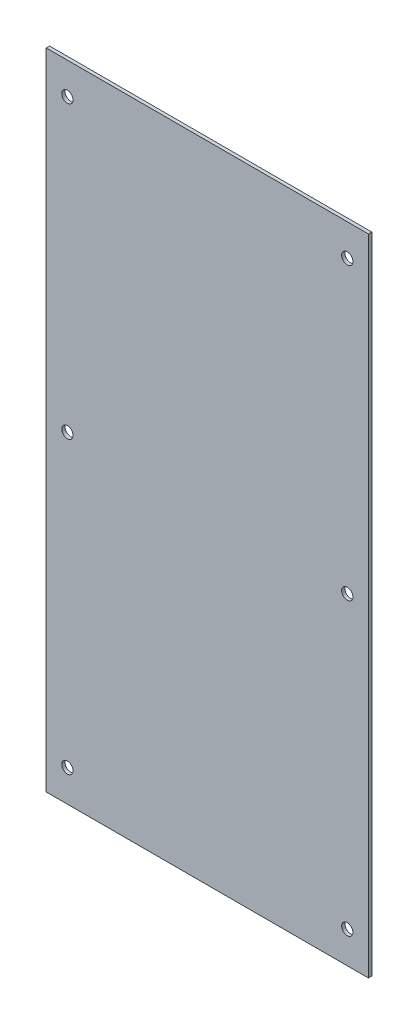
from build123d import *

# Parameters (mm, degrees)
SKETCH1_W           = 152.4
SKETCH1_H           = 304.8
BOSS_EXTRUDE1_DEPTH = 1.5748
CUT_EXTRUDE1_REACH  = 172.396
SKETCH2_R           = 2.665


with BuildPart() as part:
    # Sketch1 → Boss-Extrude1 (new body)
    with BuildSketch(Plane.XY):
        Rectangle(SKETCH1_W, SKETCH1_H)
    extrude(amount=BOSS_EXTRUDE1_DEPTH)

    # Sketch2 → Cut-Extrude1 (cut, up to next)
    with BuildSketch(Plane(origin=(0, 0, 0), x_dir=(-1, 0, 0), z_dir=(0, 0, -1)), mode=Mode.PRIVATE) as cut_extrude1_sk1:
        with Locations((-66.2, 137.4)):
            Circle(SKETCH2_R)
    cut_extrude1_tool1 = extrude(cut_extrude1_sk1.sketch, amount=-CUT_EXTRUDE1_REACH, mode=Mode.PRIVATE) & part.part
    # Sketch2 → Cut-Extrude1 (cut, up to next)
    with BuildSketch(Plane(origin=(0, 0, 0), x_dir=(-1, 0, 0), z_dir=(0, 0, -1)), mode=Mode.PRIVATE) as cut_extrude1_sk2:
        with Locations((-66.2, -137.4)):
            Circle(SKETCH2_R)
    cut_extrude1_tool2 = extrude(cut_extrude1_sk2.sketch, amount=-CUT_EXTRUDE1_REACH, mode=Mode.PRIVATE) & part.part
    # Sketch2 → Cut-Extrude1 (cut, up to next)
    with BuildSketch(Plane(origin=(0, 0, 0), x_dir=(-1, 0, 0), z_dir=(0, 0, -1)), mode=Mode.PRIVATE) as cut_extrude1_sk3:
        with Locations((-66.2, 0)):
            Circle(SKETCH2_R)
    cut_extrude1_tool3 = extrude(cut_extrude1_sk3.sketch, amount=-CUT_EXTRUDE1_REACH, mode=Mode.PRIVATE) & part.part
    # Sketch2 → Cut-Extrude1 (cut, up to next)
    with BuildSketch(Plane(origin=(0, 0, 0), x_dir=(-1, 0, 0), z_dir=(0, 0, -1)), mode=Mode.PRIVATE) as cut_extrude1_sk4:
        with Locations((66.2, -137.4)):
            Circle(SKETCH2_R)
    cut_extrude1_tool4 = extrude(cut_extrude1_sk4.sketch, amount=-CUT_EXTRUDE1_REACH, mode=Mode.PRIVATE) & part.part
    # Sketch2 → Cut-Extrude1 (cut, up to next)
    with BuildSketch(Plane(origin=(0, 0, 0), x_dir=(-1, 0, 0), z_dir=(0, 0, -1)), mode=Mode.PRIVATE) as cut_extrude1_sk5:
        with Locations((66.2, 0)):
            Circle(SKETCH2_R)
    cut_extrude1_tool5 = extrude(cut_extrude1_sk5.sketch, amount=-CUT_EXTRUDE1_REACH, mode=Mode.PRIVATE) & part.part
    # Sketch2 → Cut-Extrude1 (cut, up to next)
    with BuildSketch(Plane(origin=(0, 0, 0), x_dir=(-1, 0, 0), z_dir=(0, 0, -1)), mode=Mode.PRIVATE) as cut_extrude1_sk6:
        with Locations((66.2, 137.4)):
            Circle(SKETCH2_R)
    cut_extrude1_tool6 = extrude(cut_extrude1_sk6.sketch, amount=-CUT_EXTRUDE1_REACH, mode=Mode.PRIVATE) & part.part
    add(cut_extrude1_tool1.solids().sort_by_distance((66.2, 137.4, 0))[0], mode=Mode.SUBTRACT)
    add(cut_extrude1_tool2.solids().sort_by_distance((66.2, -137.4, 0))[0], mode=Mode.SUBTRACT)
    add(cut_extrude1_tool3.solids().sort_by_distance((66.2, 0, 0))[0], mode=Mode.SUBTRACT)
    add(cut_extrude1_tool4.solids().sort_by_distance((-66.2, -137.4, 0))[0], mode=Mode.SUBTRACT)
    add(cut_extrude1_tool5.solids().sort_by_distance((-66.2, 0, 0))[0], mode=Mode.SUBTRACT)
    add(cut_extrude1_tool6.solids().sort_by_distance((-66.2, 137.4, 0))[0], mode=Mode.SUBTRACT)


solid = part.part
